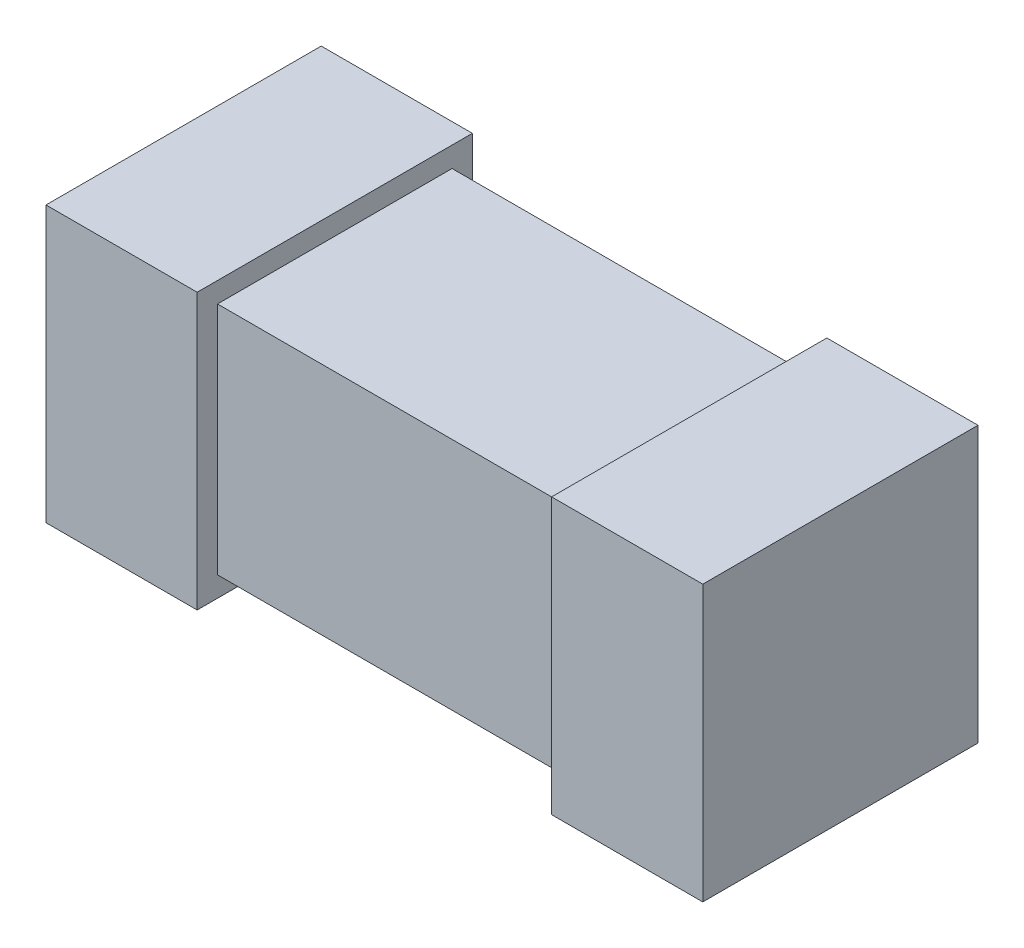
from build123d import *

# Parameters (mm, degrees)
SKETCH1_W           = 2.25
SKETCH1_H           = 2.25
BOSS_EXTRUDE1_DEPTH = 1.7
SKETCH2_W           = 2.64
SKETCH2_H           = 2.64
BOSS_EXTRUDE2_DEPTH = 1.45


with BuildPart() as part:
    # Sketch1 → Boss-Extrude1 (new, symmetric)
    with BuildSketch(Plane(origin=(0, 0, 0), x_dir=(0, 0, -1), z_dir=(1, 0, 0))):
        Rectangle(SKETCH1_W, SKETCH1_H)
    extrude(amount=BOSS_EXTRUDE1_DEPTH, both=True)

    # Sketch2 → Boss-Extrude2 (add)
    with BuildSketch(Plane(origin=(1.7, 0, 0), x_dir=(0, 0, -1), z_dir=(1, 0, 0))):
        Rectangle(SKETCH2_W, SKETCH2_H)
    boss_extrude2 = extrude(amount=BOSS_EXTRUDE2_DEPTH)

    # Mirror1: Boss-Extrude2 across plane
    add(boss_extrude2.mirror(Plane(origin=(0, 0, 0), x_dir=(0, 0, 1), z_dir=(1, 0, 0))))


solid = part.part
